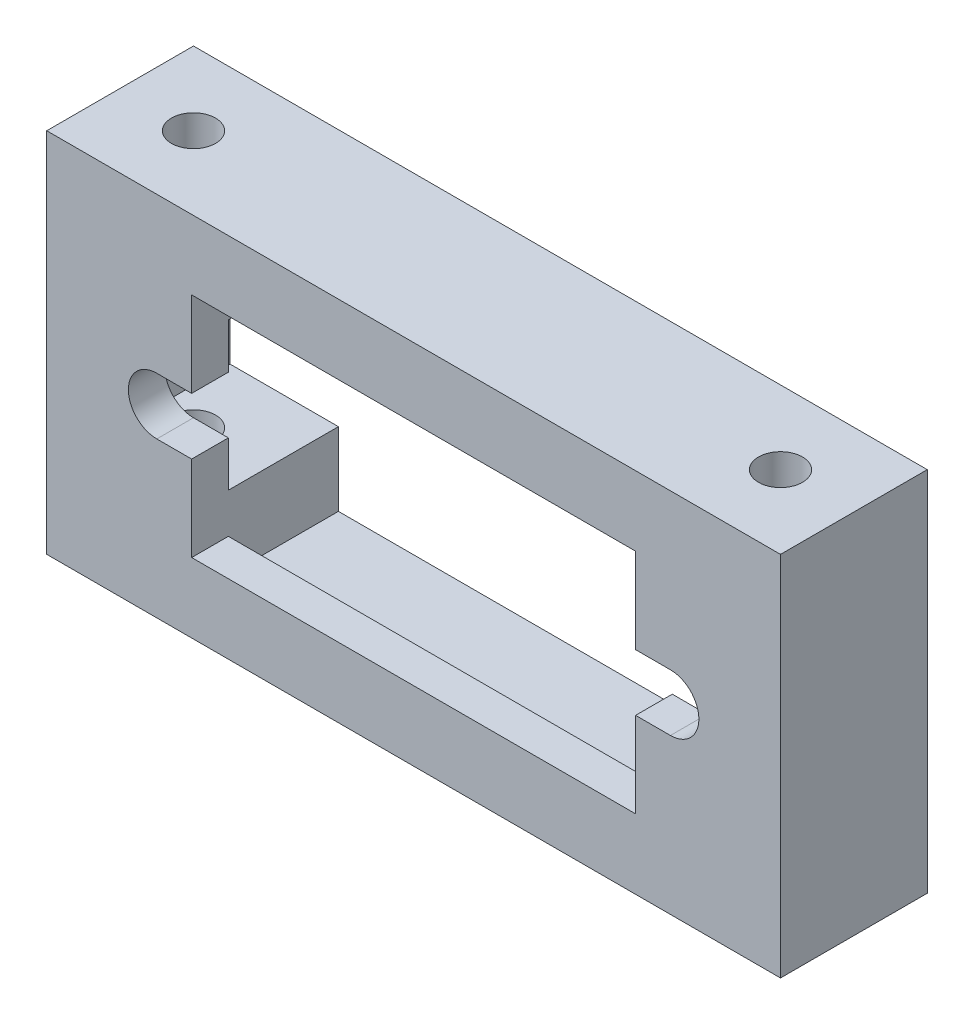
from build123d import *

# Parameters (mm, degrees)
SKETCH_1_W          = 40
SKETCH_1_H          = 20
EXTRUDE_1_DEPTH     = 2
SKETCH_2_W          = 24.2
SKETCH_2_H          = 12.4
CUT_EXTRUDE_1_DEPTH = 2
SKETCH_3_W          = 2
SKETCH_3_H          = 20
EXTRUDE_2_DEPTH     = 6
SKETCH_5_W          = 36
SKETCH_5_H          = 1.98
EXTRUDE_3_DEPTH     = 6
SKETCH_6_W          = 5.9
SKETCH_6_H          = 4
EXTRUDE_4_DEPTH     = 6
SKETCH_7_R          = 1.2
CUT_EXTRUDE_2_DEPTH = 29.91366459


with BuildPart() as part:
    # ｽｹｯﾁ1 → ﾎﾞｽ - 押し出し1 (new body)
    with BuildSketch(Plane.XY):
        Rectangle(SKETCH_1_W, SKETCH_1_H)
    extrude(amount=EXTRUDE_1_DEPTH)

    # ｽｹｯﾁ2 → ｶｯﾄ - 押し出し1 (cut)
    with BuildSketch(Plane.XY.offset(2)):
        Rectangle(SKETCH_2_W, SKETCH_2_H)
        with BuildLine():
            Line((-14, 1.55), (14, 1.55))
            ThreePointArc((14, 1.55), (15.55, 0), (14, -1.55))
            Line((14, -1.55), (-14, -1.55))
            ThreePointArc((-14, -1.55), (-15.55, 0), (-14, 1.55))
        make_face()
    extrude(amount=-CUT_EXTRUDE_1_DEPTH, mode=Mode.SUBTRACT)

    # ｽｹｯﾁ3 → ﾎﾞｽ - 押し出し2 (add)
    with BuildSketch(Plane(origin=(0, 0, 0), x_dir=(-1, 0, 0), z_dir=(0, 0, -1))):
        with Locations((19, 0)):
            Rectangle(SKETCH_3_W, SKETCH_3_H)
        with Locations((-19, 0)):
            Rectangle(SKETCH_3_W, SKETCH_3_H)
    extrude(amount=EXTRUDE_2_DEPTH)

    # ｽｹｯﾁ5 → ﾎﾞｽ - 押し出し3 (add)
    with BuildSketch(Plane(origin=(0, 0, 0), x_dir=(-1, 0, 0), z_dir=(0, 0, -1))):
        with Locations((0, 9.01)):
            Rectangle(SKETCH_5_W, SKETCH_5_H)
        with Locations((0, -9.01)):
            Rectangle(SKETCH_5_W, SKETCH_5_H)
    extrude(amount=EXTRUDE_3_DEPTH)

    # ｽｹｯﾁ6 → ﾎﾞｽ - 押し出し4 (add)
    with BuildSketch(Plane(origin=(0, 0, 0), x_dir=(-1, 0, 0), z_dir=(0, 0, -1))):
        with Locations((-15.05, 6.02)):
            Rectangle(SKETCH_6_W, SKETCH_6_H)
        with Locations((15.05, 6.02)):
            Rectangle(SKETCH_6_W, SKETCH_6_H)
        with Locations((15.05, -6.02)):
            Rectangle(SKETCH_6_W, SKETCH_6_H)
        with Locations((-15.05, -6.02)):
            Rectangle(SKETCH_6_W, SKETCH_6_H)
    extrude(amount=EXTRUDE_4_DEPTH)

    # ｽｹｯﾁ7 → ｶｯﾄ - 押し出し2 (cut, through all)
    with BuildSketch(Plane(origin=(0, 10, 0), x_dir=(1, 0, 0), z_dir=(0, 1, 0))):
        with Locations(Location((-16, 2, 0), (0, 0, 270))):
            Circle(SKETCH_7_R)
        with Locations(Location((16, 2, 0), (0, 0, 270))):
            Circle(SKETCH_7_R)
    extrude(amount=-CUT_EXTRUDE_2_DEPTH, mode=Mode.SUBTRACT)


solid = part.part
